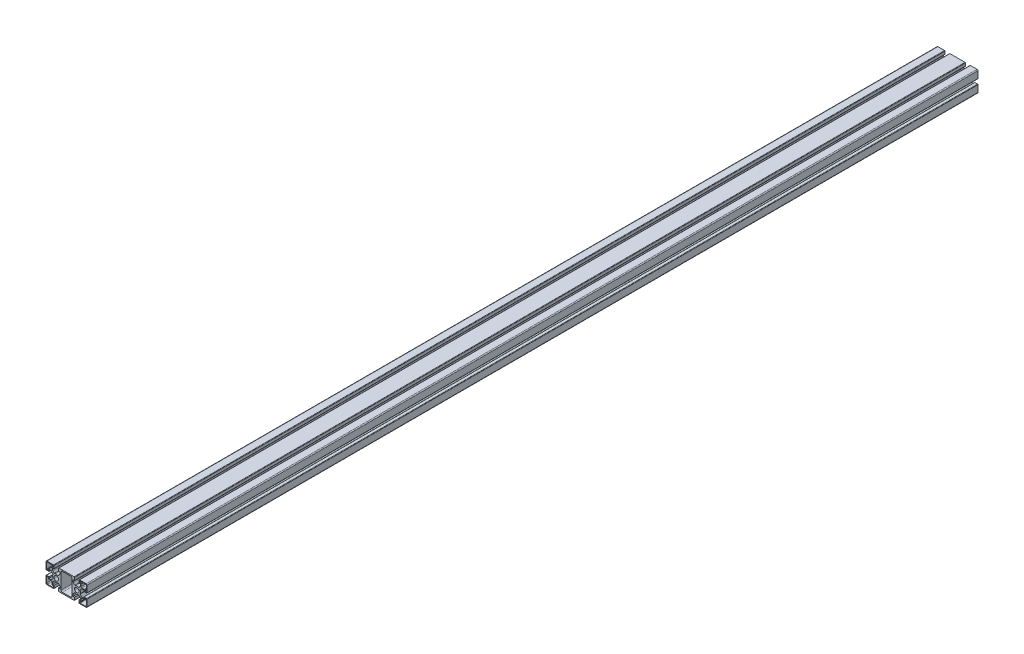
from build123d import *

# Parameters (mm, degrees)
SKETCH1_R           = 5
BOSS_EXTRUDE2_DEPTH = 1955


with BuildPart() as part:
    # Sketch1 → Boss-Extrude2 (new body)
    with BuildSketch(Plane.XY):
        with BuildLine():
            Line((-5, -15.705854984), (-8, -15.705854984))
            Line((-8, -15.705854984), (-8, -11.948495671))
            ThreePointArc((-8, -11.948495671), (-7.771638598, -10.800445374), (-7.121320344, -9.827175327))
            Line((-7.121320344, -9.827175327), (-4.66838954, -7.374244523))
            ThreePointArc((-4.66838954, -7.374244523), (-4.125357909, -7.094903463), (-3.52114023, -7.183423382))
            ThreePointArc((-3.52114023, -7.183423382), (0, -8), (3.52114023, -7.183423382))
            ThreePointArc((3.52114023, -7.183423382), (4.125357909, -7.094903463), (4.66838954, -7.374244523))
            Line((4.66838954, -7.374244523), (7.121320344, -9.827175327))
            ThreePointArc((7.121320344, -9.827175327), (7.771638598, -10.800445374), (8, -11.948495671))
            Line((8, -11.948495671), (8, -15.705854984))
            Line((8, -15.705854984), (5, -15.705854984))
            Line((5, -15.705854984), (5, -21.5))
            ThreePointArc((5, -21.5), (5.292893219, -22.207106781), (6, -22.5))
            Line((6, -22.5), (39, -22.5))
            ThreePointArc((39, -22.5), (39.707106781, -22.207106781), (40, -21.5))
            Line((40, -21.5), (40, -15.705854984))
            Line((40, -15.705854984), (37, -15.705854984))
            Line((37, -15.705854984), (37, -11.948495671))
            ThreePointArc((37, -11.948495671), (37.228361402, -10.800445374), (37.878679656, -9.827175327))
            Line((37.878679656, -9.827175327), (40.33161046, -7.374244523))
            ThreePointArc((40.33161046, -7.374244523), (40.874642091, -7.094903463), (41.47885977, -7.183423382))
            ThreePointArc((41.47885977, -7.183423382), (45, -8), (48.52114023, -7.183423382))
            ThreePointArc((48.52114023, -7.183423382), (49.125357909, -7.094903463), (49.66838954, -7.374244523))
            Line((49.66838954, -7.374244523), (52.121320344, -9.827175327))
            ThreePointArc((52.121320344, -9.827175327), (52.771638598, -10.800445374), (53, -11.948495671))
            Line((53, -11.948495671), (53, -15.705854984))
            Line((53, -15.705854984), (50, -15.705854984))
            Line((50, -15.705854984), (50, -21.5))
            ThreePointArc((50, -21.5), (50.292893219, -22.207106781), (51, -22.5))
            Line((51, -22.5), (65.5, -22.5))
            ThreePointArc((65.5, -22.5), (66.914213562, -21.914213562), (67.5, -20.5))
            Line((67.5, -20.5), (67.5, -6))
            ThreePointArc((67.5, -6), (67.207106781, -5.292893219), (66.5, -5))
            Line((66.5, -5), (60.705854984, -5))
            Line((60.705854984, -5), (60.705854984, -8))
            Line((60.705854984, -8), (56.948495671, -8))
            ThreePointArc((56.948495671, -8), (55.800445374, -7.771638598), (54.827175327, -7.121320344))
            Line((54.827175327, -7.121320344), (52.374244523, -4.66838954))
            ThreePointArc((52.374244523, -4.66838954), (52.094903463, -4.125357909), (52.183423382, -3.52114023))
            ThreePointArc((52.183423382, -3.52114023), (53, 0), (52.183423382, 3.52114023))
            ThreePointArc((52.183423382, 3.52114023), (52.094903463, 4.125357909), (52.374244523, 4.66838954))
            Line((52.374244523, 4.66838954), (54.827175327, 7.121320344))
            ThreePointArc((54.827175327, 7.121320344), (55.800445374, 7.771638598), (56.948495671, 8))
            Line((56.948495671, 8), (60.705854984, 8))
            Line((60.705854984, 8), (60.705854984, 5))
            Line((60.705854984, 5), (66.5, 5))
            ThreePointArc((66.5, 5), (67.207106781, 5.292893219), (67.5, 6))
            Line((67.5, 6), (67.5, 20.5))
            ThreePointArc((67.5, 20.5), (66.914213562, 21.914213562), (65.5, 22.5))
            Line((65.5, 22.5), (51, 22.5))
            ThreePointArc((51, 22.5), (50.292893219, 22.207106781), (50, 21.5))
            Line((50, 21.5), (50, 15.705854984))
            Line((50, 15.705854984), (53, 15.705854984))
            Line((53, 15.705854984), (53, 11.948495671))
            ThreePointArc((53, 11.948495671), (52.771638598, 10.800445374), (52.121320344, 9.827175327))
            Line((52.121320344, 9.827175327), (49.66838954, 7.374244523))
            ThreePointArc((49.66838954, 7.374244523), (49.125357909, 7.094903463), (48.52114023, 7.183423382))
            ThreePointArc((48.52114023, 7.183423382), (45, 8), (41.47885977, 7.183423382))
            ThreePointArc((41.47885977, 7.183423382), (40.874642091, 7.094903463), (40.33161046, 7.374244523))
            Line((40.33161046, 7.374244523), (37.878679656, 9.827175327))
            ThreePointArc((37.878679656, 9.827175327), (37.228361402, 10.800445374), (37, 11.948495671))
            Line((37, 11.948495671), (37, 15.705854984))
            Line((37, 15.705854984), (40, 15.705854984))
            Line((40, 15.705854984), (40, 21.5))
            ThreePointArc((40, 21.5), (39.707106781, 22.207106781), (39, 22.5))
            Line((39, 22.5), (6, 22.5))
            ThreePointArc((6, 22.5), (5.292893219, 22.207106781), (5, 21.5))
            Line((5, 21.5), (5, 15.705854984))
            Line((5, 15.705854984), (8, 15.705854984))
            Line((8, 15.705854984), (8, 11.948495671))
            ThreePointArc((8, 11.948495671), (7.771638598, 10.800445374), (7.121320344, 9.827175327))
            Line((7.121320344, 9.827175327), (4.66838954, 7.374244523))
            ThreePointArc((4.66838954, 7.374244523), (4.125357909, 7.094903463), (3.52114023, 7.183423382))
            ThreePointArc((3.52114023, 7.183423382), (0, 8), (-3.52114023, 7.183423382))
            ThreePointArc((-3.52114023, 7.183423382), (-4.125357909, 7.094903463), (-4.66838954, 7.374244523))
            Line((-4.66838954, 7.374244523), (-7.121320344, 9.827175327))
            ThreePointArc((-7.121320344, 9.827175327), (-7.771638598, 10.800445374), (-8, 11.948495671))
            Line((-8, 11.948495671), (-8, 15.705854984))
            Line((-8, 15.705854984), (-5, 15.705854984))
            Line((-5, 15.705854984), (-5, 21.5))
            ThreePointArc((-5, 21.5), (-5.292893219, 22.207106781), (-6, 22.5))
            Line((-6, 22.5), (-20.5, 22.5))
            ThreePointArc((-20.5, 22.5), (-21.914213562, 21.914213562), (-22.5, 20.5))
            Line((-22.5, 20.5), (-22.5, 6))
            ThreePointArc((-22.5, 6), (-22.207106781, 5.292893219), (-21.5, 5))
            Line((-21.5, 5), (-15.705854984, 5))
            Line((-15.705854984, 5), (-15.705854984, 8))
            Line((-15.705854984, 8), (-11.948495671, 8))
            ThreePointArc((-11.948495671, 8), (-10.800445374, 7.771638598), (-9.827175327, 7.121320344))
            Line((-9.827175327, 7.121320344), (-7.374244523, 4.66838954))
            ThreePointArc((-7.374244523, 4.66838954), (-7.094903463, 4.125357909), (-7.183423382, 3.52114023))
            ThreePointArc((-7.183423382, 3.52114023), (-8, 0), (-7.183423382, -3.52114023))
            ThreePointArc((-7.183423382, -3.52114023), (-7.094903463, -4.125357909), (-7.374244523, -4.66838954))
            Line((-7.374244523, -4.66838954), (-9.827175327, -7.121320344))
            ThreePointArc((-9.827175327, -7.121320344), (-10.800445374, -7.771638598), (-11.948495671, -8))
            Line((-11.948495671, -8), (-15.705854984, -8))
            Line((-15.705854984, -8), (-15.705854984, -5))
            Line((-15.705854984, -5), (-21.5, -5))
            ThreePointArc((-21.5, -5), (-22.207106781, -5.292893219), (-22.5, -6))
            Line((-22.5, -6), (-22.5, -20.5))
            ThreePointArc((-22.5, -20.5), (-21.914213562, -21.914213562), (-20.5, -22.5))
            Line((-20.5, -22.5), (-6, -22.5))
            ThreePointArc((-6, -22.5), (-5.292893219, -22.207106781), (-5, -21.5))
            Line((-5, -21.5), (-5, -15.705854984))
        make_face()
        Circle(SKETCH1_R, mode=Mode.SUBTRACT)
        with Locations((45, 0)):
            Circle(SKETCH1_R, mode=Mode.SUBTRACT)
        with BuildLine():
            Line((-19, -21), (-7.5, -21))
            ThreePointArc((-7.5, -21), (-6.792893219, -20.707106781), (-6.5, -20))
            Line((-6.5, -20), (-6.5, -18.205854984))
            ThreePointArc((-6.5, -18.205854984), (-6.792893219, -17.498748202), (-7.5, -17.205854984))
            Line((-7.5, -17.205854984), (-8.5, -17.205854984))
            ThreePointArc((-8.5, -17.205854984), (-9.207106781, -16.912961765), (-9.5, -16.205854984))
            Line((-9.5, -16.205854984), (-9.5, -11.5))
            ThreePointArc((-9.5, -11.5), (-10.085786438, -10.085786438), (-11.5, -9.5))
            Line((-11.5, -9.5), (-16.205854984, -9.5))
            ThreePointArc((-16.205854984, -9.5), (-16.912961765, -9.207106781), (-17.205854984, -8.5))
            Line((-17.205854984, -8.5), (-17.205854984, -7.5))
            ThreePointArc((-17.205854984, -7.5), (-17.498748202, -6.792893219), (-18.205854984, -6.5))
            Line((-18.205854984, -6.5), (-20, -6.5))
            ThreePointArc((-20, -6.5), (-20.707106781, -6.792893219), (-21, -7.5))
            Line((-21, -7.5), (-21, -19))
            ThreePointArc((-21, -19), (-20.414213562, -20.414213562), (-19, -21))
        make_face(mode=Mode.SUBTRACT)
        with BuildLine():
            Line((-9.5, 16.205854984), (-9.5, 11.5))
            ThreePointArc((-9.5, 11.5), (-10.085786438, 10.085786438), (-11.5, 9.5))
            Line((-11.5, 9.5), (-16.205854984, 9.5))
            ThreePointArc((-16.205854984, 9.5), (-16.912961765, 9.207106781), (-17.205854984, 8.5))
            Line((-17.205854984, 8.5), (-17.205854984, 7.5))
            ThreePointArc((-17.205854984, 7.5), (-17.498748202, 6.792893219), (-18.205854984, 6.5))
            Line((-18.205854984, 6.5), (-20, 6.5))
            ThreePointArc((-20, 6.5), (-20.707106781, 6.792893219), (-21, 7.5))
            Line((-21, 7.5), (-21, 19))
            ThreePointArc((-21, 19), (-20.414213562, 20.414213562), (-19, 21))
            Line((-19, 21), (-7.5, 21))
            ThreePointArc((-7.5, 21), (-6.792893219, 20.707106781), (-6.5, 20))
            Line((-6.5, 20), (-6.5, 18.205854984))
            ThreePointArc((-6.5, 18.205854984), (-6.792893219, 17.498748202), (-7.5, 17.205854984))
            Line((-7.5, 17.205854984), (-8.5, 17.205854984))
            ThreePointArc((-8.5, 17.205854984), (-9.207106781, 16.912961765), (-9.5, 16.205854984))
        make_face(mode=Mode.SUBTRACT)
        with BuildLine():
            Line((10.5, 17), (10.5, -17))
            ThreePointArc((10.5, -17), (11.378679656, -19.121320344), (13.5, -20))
            Line((13.5, -20), (31.5, -20))
            ThreePointArc((31.5, -20), (33.621320344, -19.121320344), (34.5, -17))
            Line((34.5, -17), (34.5, 17))
            ThreePointArc((34.5, 17), (33.621320344, 19.121320344), (31.5, 20))
            Line((31.5, 20), (13.5, 20))
            ThreePointArc((13.5, 20), (11.378679656, 19.121320344), (10.5, 17))
        make_face(mode=Mode.SUBTRACT)
        with BuildLine():
            Line((52.5, 17.205854984), (53.5, 17.205854984))
            ThreePointArc((53.5, 17.205854984), (54.207106781, 16.912961765), (54.5, 16.205854984))
            Line((54.5, 16.205854984), (54.5, 11.5))
            ThreePointArc((54.5, 11.5), (55.085786438, 10.085786438), (56.5, 9.5))
            Line((56.5, 9.5), (61.205854984, 9.5))
            ThreePointArc((61.205854984, 9.5), (61.912961765, 9.207106781), (62.205854984, 8.5))
            Line((62.205854984, 8.5), (62.205854984, 7.5))
            ThreePointArc((62.205854984, 7.5), (62.498748202, 6.792893219), (63.205854984, 6.5))
            Line((63.205854984, 6.5), (65, 6.5))
            ThreePointArc((65, 6.5), (65.707106781, 6.792893219), (66, 7.5))
            Line((66, 7.5), (66, 19))
            ThreePointArc((66, 19), (65.414213562, 20.414213562), (64, 21))
            Line((64, 21), (52.5, 21))
            ThreePointArc((52.5, 21), (51.792893219, 20.707106781), (51.5, 20))
            Line((51.5, 20), (51.5, 18.205854984))
            ThreePointArc((51.5, 18.205854984), (51.792893219, 17.498748202), (52.5, 17.205854984))
        make_face(mode=Mode.SUBTRACT)
        with BuildLine():
            Line((66, -19), (66, -7.5))
            ThreePointArc((66, -7.5), (65.707106781, -6.792893219), (65, -6.5))
            Line((65, -6.5), (63.205854984, -6.5))
            ThreePointArc((63.205854984, -6.5), (62.498748202, -6.792893219), (62.205854984, -7.5))
            Line((62.205854984, -7.5), (62.205854984, -8.5))
            ThreePointArc((62.205854984, -8.5), (61.912961765, -9.207106781), (61.205854984, -9.5))
            Line((61.205854984, -9.5), (56.5, -9.5))
            ThreePointArc((56.5, -9.5), (55.085786438, -10.085786438), (54.5, -11.5))
            Line((54.5, -11.5), (54.5, -16.205854984))
            ThreePointArc((54.5, -16.205854984), (54.207106781, -16.912961765), (53.5, -17.205854984))
            Line((53.5, -17.205854984), (52.5, -17.205854984))
            ThreePointArc((52.5, -17.205854984), (51.792893219, -17.498748202), (51.5, -18.205854984))
            Line((51.5, -18.205854984), (51.5, -20))
            ThreePointArc((51.5, -20), (51.792893219, -20.707106781), (52.5, -21))
            Line((52.5, -21), (64, -21))
            ThreePointArc((64, -21), (65.414213562, -20.414213562), (66, -19))
        make_face(mode=Mode.SUBTRACT)
    extrude(amount=BOSS_EXTRUDE2_DEPTH)


solid = part.part
